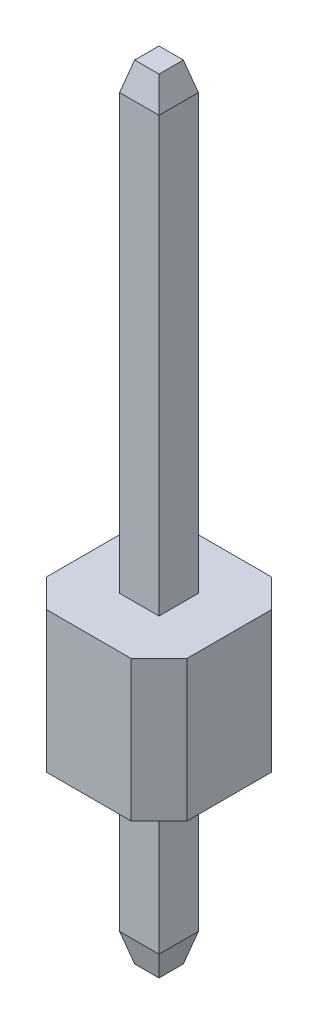
from build123d import *

# Parameters (mm, degrees)
SKETCH3_W                = 2.5
SKETCH3_H                = 2.5
BOSS_EXTRUDE1_DEPTH      = 1.25
CHAMFER1_SIZE            = 0.5
BOSS_EXTRUDE2_DEPTH      = 7.7
BOSS_EXTRUDE2_DEPTH_BACK = 5.2
SKETCH5_W                = 0.7
SKETCH5_H                = 0.7
SKETCH6_W                = 0.7
SKETCH6_H                = 0.7
BOSS_EXTRUDE3_DEPTH      = 0.5
BOSS_EXTRUDE3_TAPER      = 15
SKETCH7_W                = 0.7
SKETCH7_H                = 0.7
BOSS_EXTRUDE4_DEPTH      = 0.5
BOSS_EXTRUDE4_TAPER      = 15


with BuildPart() as part:
    # Sketch3 → Boss-Extrude1 (new, symmetric)
    with BuildSketch(Plane(origin=(0, 0, 0), x_dir=(1, 0, 0), z_dir=(0, 1, 0))):
        Rectangle(SKETCH3_W, SKETCH3_H)
    extrude(amount=BOSS_EXTRUDE1_DEPTH, both=True)

    # Chamfer1
    chamfer1_edges = [part.edges().sort_by_distance(p)[0] for p in [
        (1.25, 0, 1.25),
        (-1.25, 0, 1.25),
        (-1.25, 0, -1.25),
        (1.25, 0, -1.25),
    ]]
    chamfer(chamfer1_edges, length=CHAMFER1_SIZE)


with BuildPart() as body_2:
    # Sketch5 → Boss-Extrude2 (new, two sides: drawn at the far end of the back side and taken through both)
    with BuildSketch(Plane(origin=(0, 1.25, 0), x_dir=(1, 0, 0), z_dir=(0, 1, 0)).offset(-BOSS_EXTRUDE2_DEPTH_BACK)):
        Rectangle(SKETCH5_W, SKETCH5_H)
    extrude(amount=BOSS_EXTRUDE2_DEPTH + BOSS_EXTRUDE2_DEPTH_BACK)

    # Sketch6 → Boss-Extrude3 (add)
    with BuildSketch(Plane(origin=(0, 8.95, 0), x_dir=(1, 0, 0), z_dir=(0, 1, 0))):
        Rectangle(SKETCH6_W, SKETCH6_H)
    extrude(amount=BOSS_EXTRUDE3_DEPTH, taper=BOSS_EXTRUDE3_TAPER)

    # Sketch7 → Boss-Extrude4 (add)
    with BuildSketch(Plane.XZ.offset(3.95)):
        Rectangle(SKETCH7_W, SKETCH7_H)
    extrude(amount=BOSS_EXTRUDE4_DEPTH, taper=BOSS_EXTRUDE4_TAPER)


solid = Compound([part.part, body_2.part])
